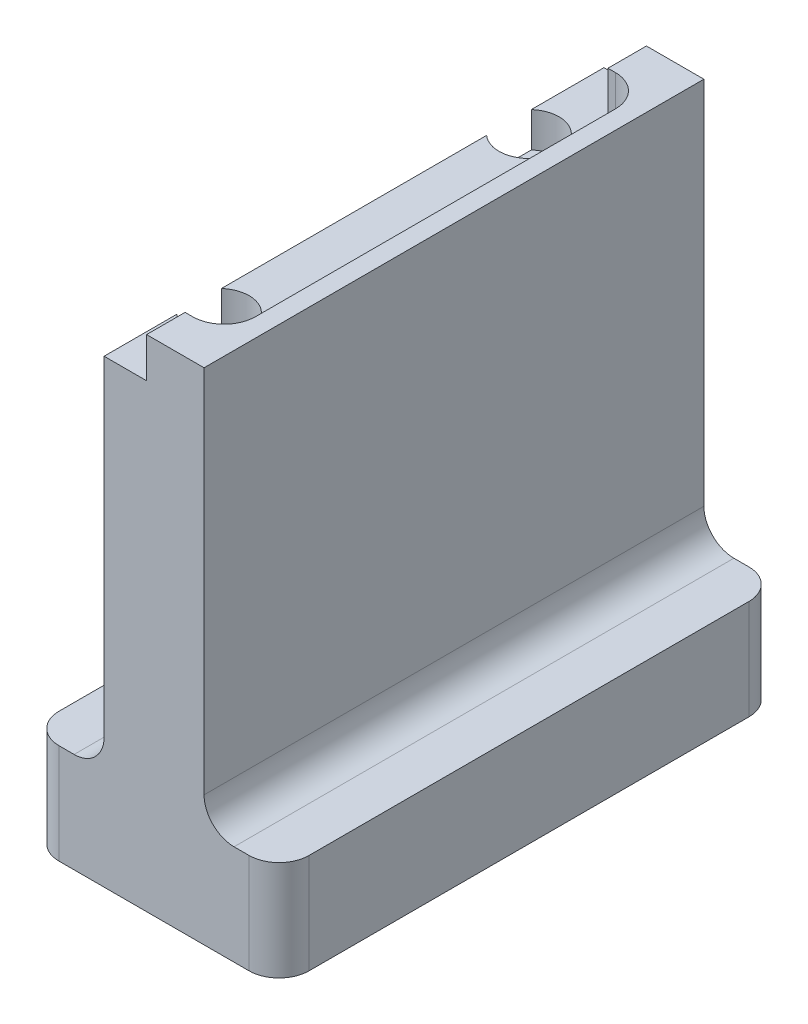
from build123d import *

# Parameters (mm, degrees)
CROQUIS1_W              = 25
CROQUIS1_H              = 50
SALIENTE_EXTRUIR1_DEPTH = 10
CROQUIS2_W              = 10
CROQUIS2_H              = 50
SALIENTE_EXTRUIR2_DEPTH = 40
CROQUIS3_W              = 8
CROQUIS3_H              = 42
CORTAR_EXTRUIR1_DEPTH   = 4
REDONDEO1_R             = 3
CROQUIS4_W              = 4.1
CROQUIS4_H              = 50
CORTAR_EXTRUIR2_DEPTH   = 4
CROQUIS5_R              = 3
CORTAR_EXTRUIR3_DEPTH   = 3.5
CORTAR_EXTRUIR4_START   = -4
CORTAR_EXTRUIR4_DEPTH   = 4
REDONDEO2_R             = 3
CROQUIS7_R              = 11.5
CORTAR_EXTRUIR5_DEPTH   = 15


with BuildPart() as part:
    # Croquis1 → Saliente-Extruir1 (new body)
    with BuildSketch(Plane(origin=(0, 0, 0), x_dir=(1, 0, 0), z_dir=(0, 1, 0))):
        with Locations((12.5, 25)):
            Rectangle(CROQUIS1_W, CROQUIS1_H)
    extrude(amount=SALIENTE_EXTRUIR1_DEPTH)

    # Croquis2 → Saliente-Extruir2 (add)
    with BuildSketch(Plane(origin=(0, 10, 0), x_dir=(1, 0, 0), z_dir=(0, 1, 0))):
        with Locations((12.5, 25)):
            Rectangle(CROQUIS2_W, CROQUIS2_H)
    extrude(amount=SALIENTE_EXTRUIR2_DEPTH)

    # Croquis3 → Cortar-Extruir1 (cut)
    with BuildSketch(Plane(origin=(0, 50, 0), x_dir=(1, 0, 0), z_dir=(0, 1, 0))):
        with Locations((11.5, 25)):
            Rectangle(CROQUIS3_W, CROQUIS3_H)
    extrude(amount=-CORTAR_EXTRUIR1_DEPTH, mode=Mode.SUBTRACT)

    # Redondeo1
    redondeo1_edges = [part.edges().sort_by_distance(p)[0] for p in [
        (15.5, 48, -46),
        (15.5, 48, -4),
    ]]
    fillet(redondeo1_edges, radius=REDONDEO1_R)

    # Croquis4 → Cortar-Extruir2 (cut)
    with BuildSketch(Plane(origin=(0, 50, 0), x_dir=(1, 0, 0), z_dir=(0, 1, 0))):
        with Locations((9.55, 25)):
            Rectangle(CROQUIS4_W, CROQUIS4_H)
    extrude(amount=-CORTAR_EXTRUIR2_DEPTH, mode=Mode.SUBTRACT)

    # Croquis5 → Cortar-Extruir3 (cut)
    with BuildSketch(Plane(origin=(0, 46, 0), x_dir=(1, 0, 0), z_dir=(0, 1, 0))):
        with Locations((9.5, 9.5)):
            Circle(CROQUIS5_R)
        with Locations((9.5, 40.5)):
            Circle(CROQUIS5_R)
    extrude(amount=-CORTAR_EXTRUIR3_DEPTH, mode=Mode.SUBTRACT)

    # Croquis6 → Cortar-Extruir4 (cut)
    with BuildSketch(Plane(origin=(0, 50, 0), x_dir=(1, 0, 0), z_dir=(0, 1, 0)).offset(CORTAR_EXTRUIR4_START)):
        with BuildLine():
            Line((11.6, 4), (12.5, 4))
            ThreePointArc((12.5, 4), (14.621320344, 4.878679656), (15.5, 7))
            Line((15.5, 7), (15.5, 43))
            ThreePointArc((15.5, 43), (14.621320344, 45.121320344), (12.5, 46))
            Line((12.5, 46), (11.6, 46))
            Line((11.6, 46), (11.6, 50))
            Line((11.6, 50), (11.75, 50))
            Line((11.75, 50), (11.75, 46.15))
            Line((11.75, 46.15), (12.5, 46.15))
            ThreePointArc((12.5, 46.15), (14.727386361, 45.227386361), (15.65, 43))
            Line((15.65, 43), (15.65, 7))
            ThreePointArc((15.65, 7), (14.727386361, 4.772613639), (12.5, 3.85))
            Line((12.5, 3.85), (11.75, 3.85))
            Line((11.75, 3.85), (11.75, 0))
            Line((11.75, 0), (11.6, 0))
            Line((11.6, 0), (11.6, 4))
        make_face()
    extrude(amount=CORTAR_EXTRUIR4_DEPTH, mode=Mode.SUBTRACT)

    # Redondeo2
    redondeo2_edges = [part.edges().sort_by_distance(p)[0] for p in [
        (7.5, 10, -25),
        (17.5, 10, -25),
        (0, 5, -50),
        (25, 5, -50),
        (25, 5, 0),
        (0, 5, 0),
    ]]
    fillet(redondeo2_edges, radius=REDONDEO2_R)

    # Croquis7 → Cortar-Extruir5 (cut)
    with BuildSketch(Plane.XZ):
        with Locations((-6, -25)):
            Circle(CROQUIS7_R)
    extrude(amount=-CORTAR_EXTRUIR5_DEPTH, mode=Mode.SUBTRACT)


solid = part.part
